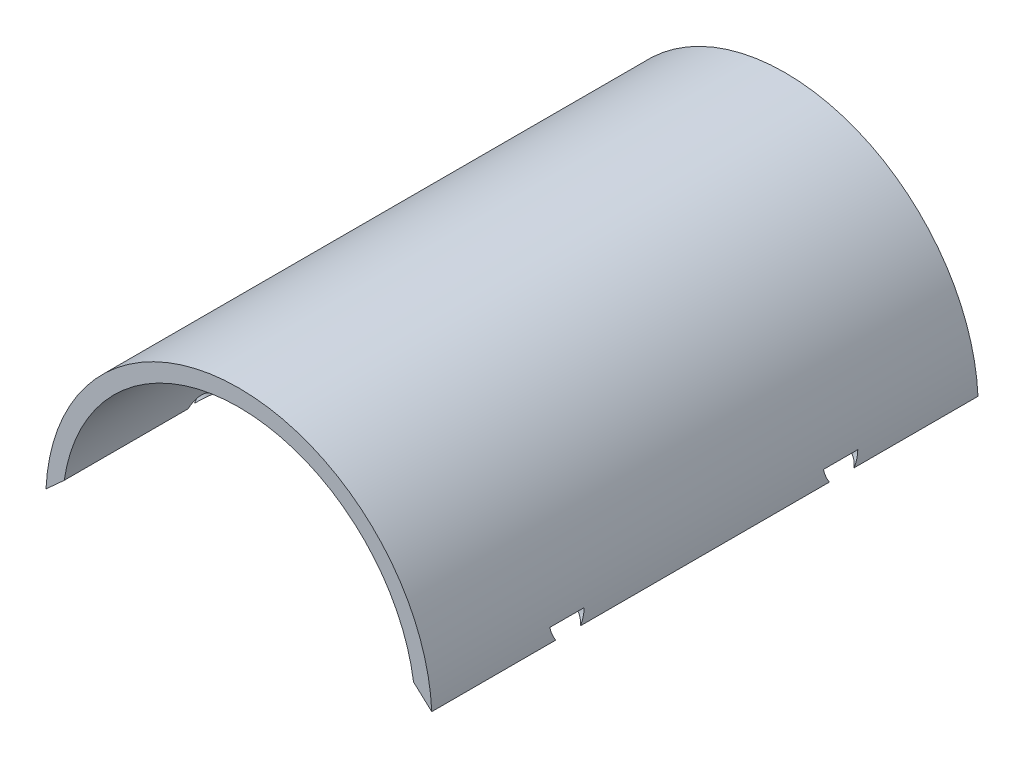
from build123d import *

# Parameters (mm, degrees)
BOSS_EXTRUDE1_DEPTH = 125.73
SKETCH2_R           = 4
CUT_EXTRUDE1_DEPTH  = 2
SKETCH3_R           = 4
CUT_EXTRUDE2_DEPTH  = 2.032


with BuildPart() as part:
    # Sketch1 → Boss-Extrude1 (new body)
    with BuildSketch(Plane.XY):
        with BuildLine():
            Line((-40.203883769, 5.937788296), (-44.399042974, 2.127788296))
            ThreePointArc((-44.399042974, 2.127788296), (0, 44.45), (44.399042974, 2.127788296))
            Line((44.399042974, 2.127788296), (40.203883769, 5.937788296))
            ThreePointArc((40.203883769, 5.937788296), (0, 40.64), (-40.203883769, 5.937788296))
        make_face()
    extrude(amount=BOSS_EXTRUDE1_DEPTH)

    # Sketch2 → Cut-Extrude1 (cut)
    with BuildSketch(Plane(origin=(-21.127225221, 23.263011377, 0), x_dir=(0.7402720771062569, 0.6723074087475075, 0), z_dir=(0.6723074087475075, -0.7402720771062569, 0))):
        with Locations((-28.603318705, 94.361)):
            Circle(SKETCH2_R)
        with Locations((-28.603318705, 31.369)):
            Circle(SKETCH2_R)
    extrude(amount=-CUT_EXTRUDE1_DEPTH, mode=Mode.SUBTRACT)

    # Sketch3 → Cut-Extrude2 (cut)
    with BuildSketch(Plane(origin=(21.127225221, 23.263011377, 0), x_dir=(-0.7402720771062569, 0.6723074087475075, 0), z_dir=(-0.6723074087475075, -0.7402720771062569, 0))):
        with Locations((-28.603318705, -94.361)):
            Circle(SKETCH3_R)
        with Locations((-28.603318705, -31.369)):
            Circle(SKETCH3_R)
    extrude(amount=-CUT_EXTRUDE2_DEPTH, mode=Mode.SUBTRACT)


solid = part.part
